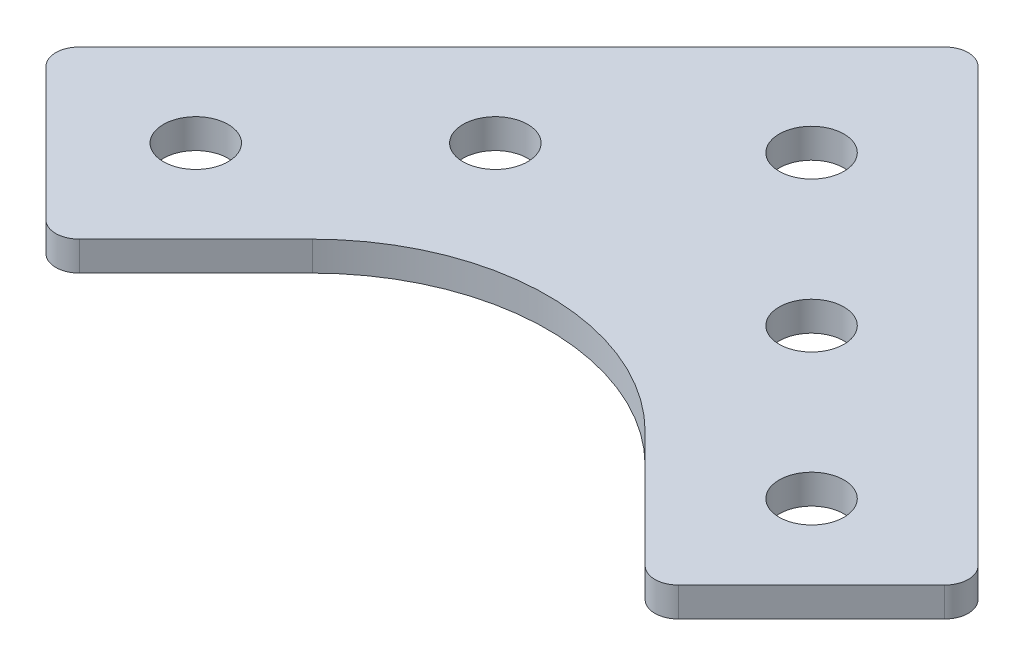
from build123d import *

# Parameters (mm, degrees)
BOSS_EXTRUDE1_DEPTH = 3.175
SKETCH2_R           = 3.4925
CUT_EXTRUDE2_DEPTH  = 3.175
LPATTERN5_COUNT     = 2
LPATTERN5_PITCH     = 22.86
SKETCH7_R           = 3.4925
CUT_EXTRUDE3_DEPTH  = 3.175
LPATTERN6_COUNT     = 3
LPATTERN6_PITCH     = 22.86
FILLET1_R           = 2.54
FILLET2_R           = 25.4


with BuildPart() as part:
    # Sketch1 → Boss-Extrude1 (new body)
    with BuildSketch(Plane(origin=(0, 0, 0), x_dir=(1, 0, 0), z_dir=(0, 1, 0))):
        Polygon((-17.960512242, 17.960512242), (0, 35.921024484), (17.960512242, 17.960512242), (50.289434278, -14.368409794), (32.328922036, -32.328922036), (0, 0), (-32.328922036, -32.328922036), (-50.289434278, -14.368409794), align=None)
    extrude(amount=BOSS_EXTRUDE1_DEPTH)

    # Sketch2 → Cut-Extrude2 (cut)
    with BuildSketch(Plane(origin=(0, 3.175, 0), x_dir=(1, 0, 0), z_dir=(0, 1, 0))):
        with Locations(Location((-33.226947648, -15.266435406, 0), (0, 0, 270))):
            Circle(SKETCH2_R)
    cut_extrude2 = extrude(amount=-CUT_EXTRUDE2_DEPTH, mode=Mode.SUBTRACT)

    # LPattern5: Cut-Extrude2 ×2
    with Locations(*[Vector(0.7071067811865465, 0, -0.7071067811865487) * (i * LPATTERN5_PITCH) for i in range(1, LPATTERN5_COUNT)]):
        add(cut_extrude2, mode=Mode.SUBTRACT)

    # Sketch7 → Cut-Extrude3 (cut)
    with BuildSketch(Plane(origin=(0, 3.175, 0), x_dir=(1, 0, 0), z_dir=(0, 1, 0))):
        with Locations(Location((33.226947648, -15.266435406, 0), (0, 0, 270))):
            Circle(SKETCH7_R)
    cut_extrude3 = extrude(amount=-CUT_EXTRUDE3_DEPTH, mode=Mode.SUBTRACT)

    # LPattern6: Cut-Extrude3 ×3
    with Locations(*[Vector(-0.7071067811865456, 0, -0.7071067811865496) * (i * LPATTERN6_PITCH) for i in range(1, LPATTERN6_COUNT)]):
        add(cut_extrude3, mode=Mode.SUBTRACT)

    # Fillet1
    fillet1_edges = [part.edges().sort_by_distance(p)[0] for p in [
        (0, 1.5875, -35.921024484),
        (50.289434278, 1.5875, 14.368409794),
        (32.328922036, 1.5875, 32.328922036),
        (-32.328922036, 1.5875, 32.328922036),
        (-50.289434278, 1.5875, 14.368409794),
    ]]
    fillet(fillet1_edges, radius=FILLET1_R)

    # Fillet2
    fillet2_edges = [part.edges().sort_by_distance(p)[0] for p in [
        (0, 1.5875, 0),
    ]]
    fillet(fillet2_edges, radius=FILLET2_R)


solid = part.part
